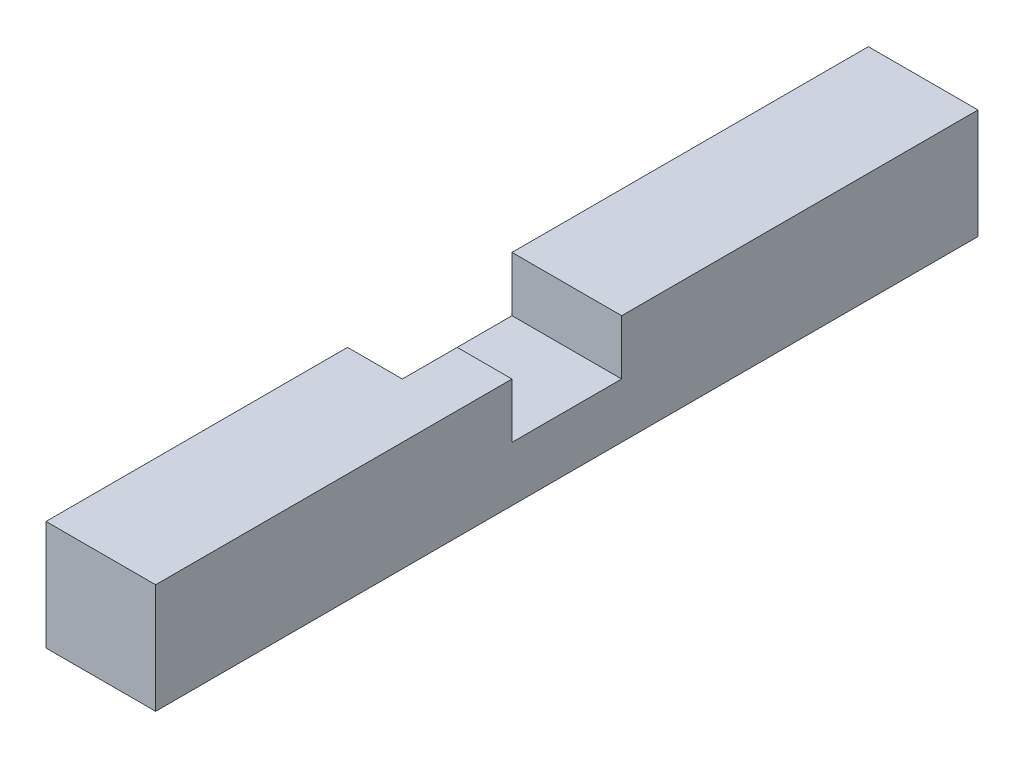
from build123d import *

# Parameters (mm, degrees)
SKETCH_1_W          = 4
SKETCH_1_H          = 4
EXTRUDE_1_DEPTH     = 30
SKETCH_4_W          = 4
SKETCH_4_H          = 2
CUT_EXTRUDE_2_DEPTH = 4
SKETCH_5_W          = 2
SKETCH_5_H          = 2
CUT_EXTRUDE_3_DEPTH = 2
SKETCH_6_W          = 2
SKETCH_6_H          = 4
CUT_EXTRUDE_5_DEPTH = 2


with BuildPart() as part:
    # 草圖1 → 填料-伸長1 (new body)
    with BuildSketch(Plane.XY):
        Rectangle(SKETCH_1_W, SKETCH_1_H)
    extrude(amount=EXTRUDE_1_DEPTH)

    # 草圖4 → 除料-伸長2 (cut)
    with BuildSketch(Plane.ZY.offset(2)):
        with Locations((15, 1)):
            Rectangle(SKETCH_4_W, SKETCH_4_H)
    extrude(amount=-CUT_EXTRUDE_2_DEPTH, mode=Mode.SUBTRACT)

    # 草圖5 → 除料-伸長3 (cut)
    with BuildSketch(Plane.ZY.offset(2)):
        with Locations((16, -1)):
            Rectangle(SKETCH_5_W, SKETCH_5_H)
    extrude(amount=-CUT_EXTRUDE_3_DEPTH, mode=Mode.SUBTRACT)

    # 草圖6 → 除料-伸長5 (cut)
    with BuildSketch(Plane.ZY.offset(2)):
        with Locations((18, 0)):
            Rectangle(SKETCH_6_W, SKETCH_6_H)
    extrude(amount=-CUT_EXTRUDE_5_DEPTH, mode=Mode.SUBTRACT)


solid = part.part
